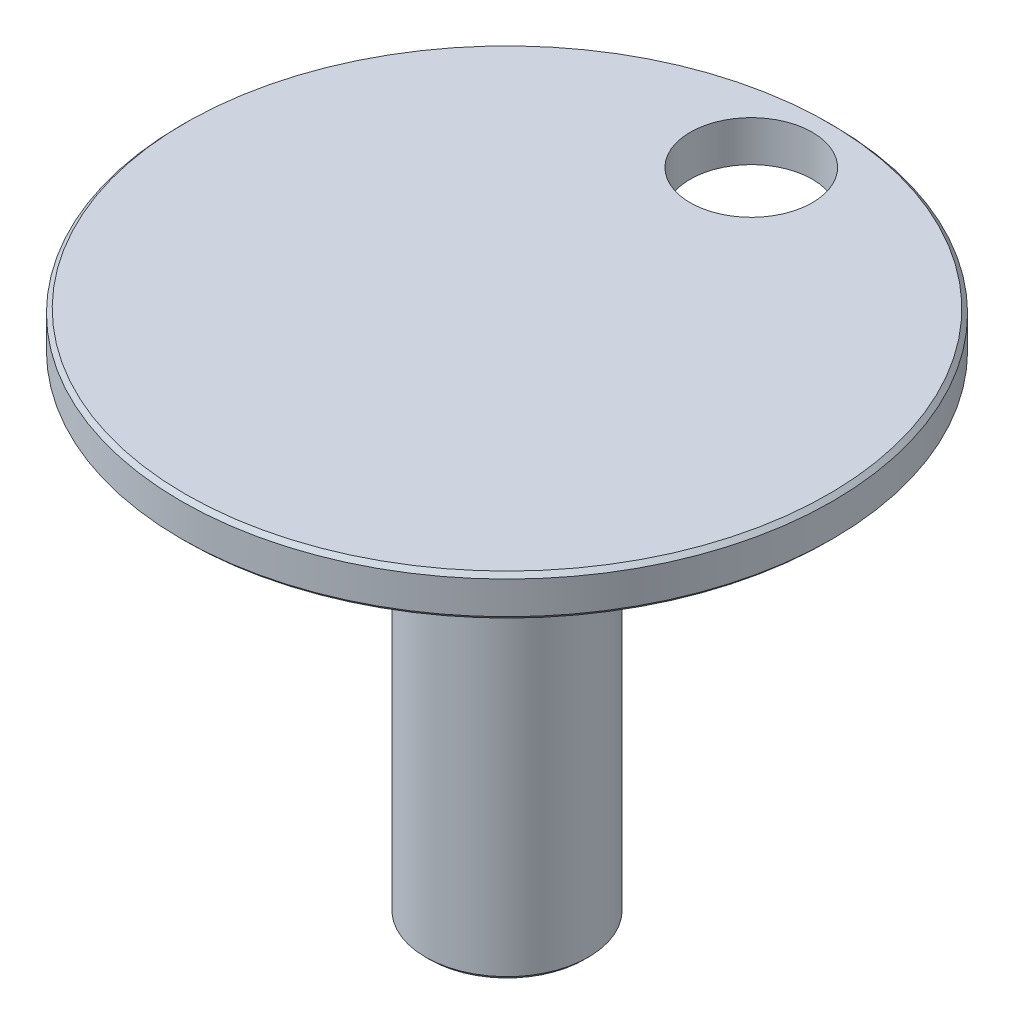
from build123d import *

# Parameters (mm, degrees)
SKETCH1_R           = 2
BOSS_EXTRUDE1_DEPTH = 11.6
SKETCH2_R           = 4
BOSS_EXTRUDE2_DEPTH = 0.3
SKETCH3_R           = 8
BOSS_EXTRUDE3_DEPTH = 1
SKETCH4_R           = 1.5
CUT_EXTRUDE1_DEPTH  = 8.5
CUT_EXTRUDE2_DEPTH  = 17.419805115
CHAMFER1_SIZE       = 0.1


with BuildPart() as part:
    # Sketch1 → Boss-Extrude1 (new body)
    with BuildSketch(Plane(origin=(0, 0, 0), x_dir=(1, 0, 0), z_dir=(0, 1, 0))):
        with Locations(Location((0, 0, 0), (0, 0, 270))):
            Circle(SKETCH1_R)
    extrude(amount=BOSS_EXTRUDE1_DEPTH)

    # Sketch2 → Boss-Extrude2 (add)
    with BuildSketch(Plane(origin=(0, 11.6, 0), x_dir=(1, 0, 0), z_dir=(0, 1, 0))):
        with Locations(Location((0, 0, 0), (0, 0, 270))):
            Circle(SKETCH2_R)
    extrude(amount=BOSS_EXTRUDE2_DEPTH)

    # Sketch3 → Boss-Extrude3 (add)
    with BuildSketch(Plane(origin=(0, 11.9, 0), x_dir=(1, 0, 0), z_dir=(0, 1, 0))):
        with Locations(Location((0, 0, 0), (0, 0, 270))):
            Circle(SKETCH3_R)
    extrude(amount=BOSS_EXTRUDE3_DEPTH)

    # Sketch4 → Cut-Extrude1 (cut)
    with BuildSketch(Plane.XZ):
        with Locations(Location((0, 0, 0), (0, 0, 270))):
            Circle(SKETCH4_R)
    extrude(amount=-CUT_EXTRUDE1_DEPTH, mode=Mode.SUBTRACT)

    # Sketch5 → Cut-Extrude2 (cut, through all)
    with BuildSketch(Plane.XZ.offset(-11.9)):
        with BuildLine():
            ThreePointArc((1.5, -6), (1.060660172, -4.939339828), (0, -4.5))
            Line((0, -4.5), (0, -7.5))
            ThreePointArc((0, -7.5), (1.060660172, -7.060660172), (1.5, -6))
        make_face()
        with BuildLine():
            Line((0, -7.5), (0, -4.5))
            ThreePointArc((0, -4.5), (-1.5, -6), (0, -7.5))
        make_face()
    extrude(amount=-CUT_EXTRUDE2_DEPTH, mode=Mode.SUBTRACT)

    # Chamfer1
    chamfer1_edges = [part.edges().sort_by_distance(p)[0] for p in [
        (0, 12.9, -8),
        (0, 0, -2),
        (0, 11.6, -2),
        (0, 11.9, -8),
    ]]
    chamfer(chamfer1_edges, length=CHAMFER1_SIZE)


solid = part.part
